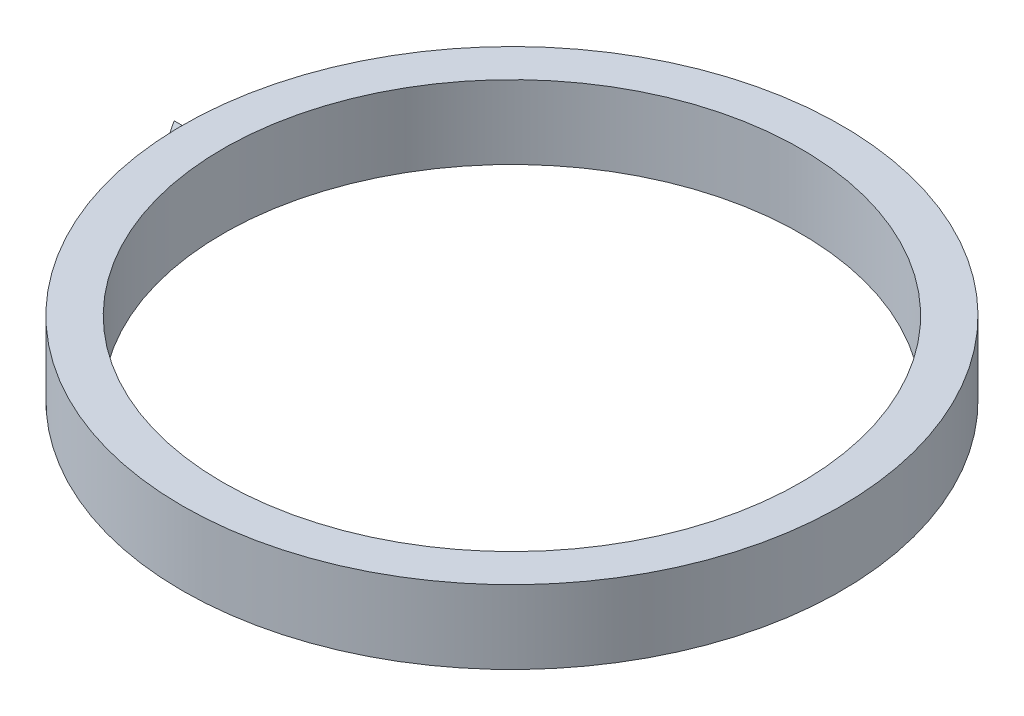
from build123d import *
from OCP.BRepFilletAPI import BRepFilletAPI_MakeChamfer

# Parameters (mm, degrees)
SKETCH1_R           = 19.5
SKETCH1_R_2         = 17.1
BOSS_EXTRUDE1_DEPTH = 4.347826087
BOSS_EXTRUDE2_DEPTH = 1.08695652
CHAMFER1_SIZE       = 0.6
CHAMFER1_SIZE2      = 0.971


with BuildPart() as part:
    # Sketch1 → Boss-Extrude1 (new body)
    with BuildSketch(Plane(origin=(0, 0, 0), x_dir=(1, 0, 0), z_dir=(0, 1, 0))):
        with Locations(Location((0, 0, 0), (0, 0, 270))):
            Circle(SKETCH1_R)
        with Locations(Location((0, 0, 0), (0, 0, 270))):
            Circle(SKETCH1_R_2, mode=Mode.SUBTRACT)
    extrude(amount=BOSS_EXTRUDE1_DEPTH)

    # Sketch2 → Boss-Extrude2 (add, symmetric)
    with BuildSketch(Plane.ZY.offset(19.5)):
        Polygon((0, 0.00928426), (-1.086956522, 2.173913043), (0, 4.338541827), (1.086956522, 2.173913043), align=None)
    extrude(amount=BOSS_EXTRUDE2_DEPTH, both=True)

    # Chamfer1: one chamfer whose edges measure the first distance from different faces: ONE call of the kernel's chamfer builder (chamfer() names one face for all edges)
    chamfer1_edges_1 = [part.edges().sort_by_distance(p)[0] for p in [
        (-20.58695652, 3.256227435, -0.543478261),
    ]]
    chamfer1_side_1 = [part.faces().sort_by_distance(p)[0] for p in [
        (-20.038389639, 3.251243161, -0.545981087),
    ]]
    chamfer1_edges_2 = [part.edges().sort_by_distance(p)[0] for p in [
        (-20.58695652, 1.091598652, -0.543478261),
    ]]
    chamfer1_side_2 = [part.faces().sort_by_distance(p)[0] for p in [
        (-20.038389639, 1.096582926, -0.545981087),
    ]]
    chamfer1_edges_3 = [part.edges().sort_by_distance(p)[0] for p in [
        (-20.58695652, 1.091598652, 0.543478261),
    ]]
    chamfer1_side_3 = [part.faces().sort_by_distance(p)[0] for p in [
        (-20.038389639, 1.096582926, 0.545981087),
    ]]
    chamfer1_edges_4 = [part.edges().sort_by_distance(p)[0] for p in [
        (-20.58695652, 3.256227435, 0.543478261),
    ]]
    chamfer1_side_4 = [part.faces().sort_by_distance(p)[0] for p in [
        (-20.038389639, 3.251243161, 0.545981087),
    ]]
    chamfer1 = BRepFilletAPI_MakeChamfer(part.part.solid().wrapped)
    for e in chamfer1_edges_1:
        chamfer1.Add(CHAMFER1_SIZE, CHAMFER1_SIZE2, e.wrapped, chamfer1_side_1[0].wrapped)  # the first distance lies on this face
    for e in chamfer1_edges_2:
        chamfer1.Add(CHAMFER1_SIZE, CHAMFER1_SIZE2, e.wrapped, chamfer1_side_2[0].wrapped)  # the first distance lies on this face
    for e in chamfer1_edges_3:
        chamfer1.Add(CHAMFER1_SIZE, CHAMFER1_SIZE2, e.wrapped, chamfer1_side_3[0].wrapped)  # the first distance lies on this face
    for e in chamfer1_edges_4:
        chamfer1.Add(CHAMFER1_SIZE, CHAMFER1_SIZE2, e.wrapped, chamfer1_side_4[0].wrapped)  # the first distance lies on this face
    add(Compound.cast(chamfer1.Shape()), mode=Mode.REPLACE)


solid = part.part
